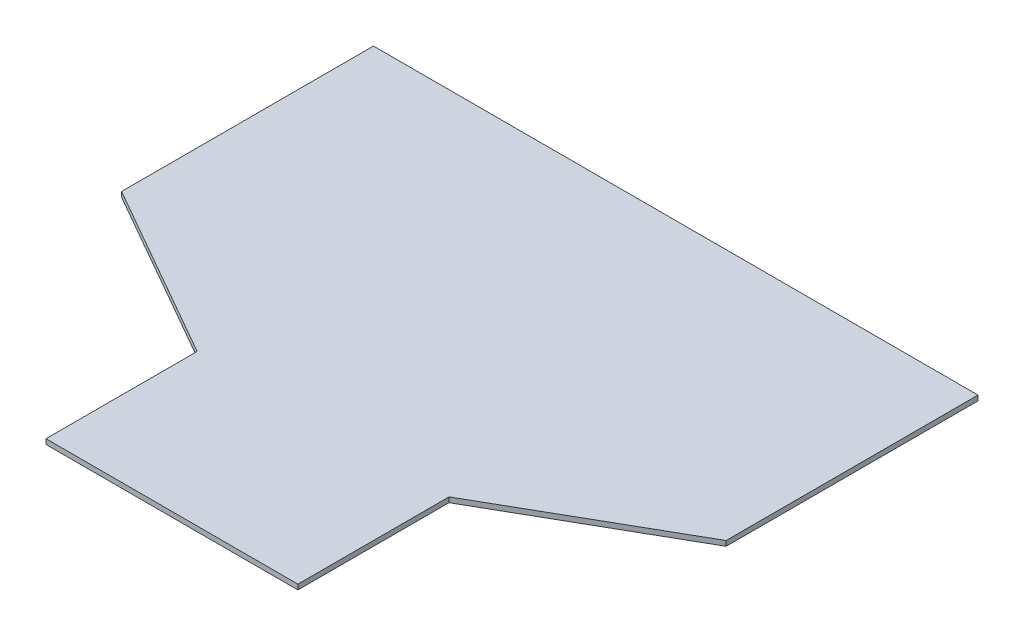
from build123d import *

# Parameters (mm, degrees)
BOSS_EXTRUDE1_DEPTH = 2.54


with BuildPart() as part:
    # Sketch1 → Boss-Extrude1 (new body)
    with BuildSketch(Plane(origin=(0, 0, 0), x_dir=(1, 0, 0), z_dir=(0, 1, 0))):
        Polygon((-152.4, 0), (152.4, 0), (152.4, -127), (63.5, -177.8), (63.5, -254), (-63.5, -254), (-63.5, -177.8), (-152.4, -127), align=None)
    extrude(amount=BOSS_EXTRUDE1_DEPTH)


solid = part.part
